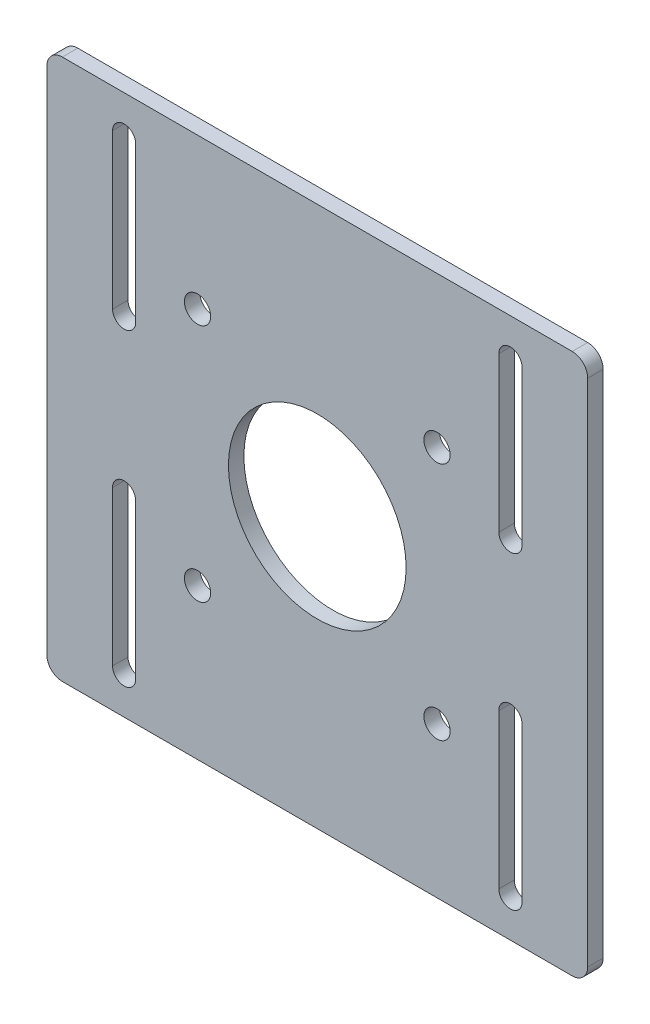
from build123d import *

# Parameters (mm, degrees)
SKIZZE1_W                        = 70
SKIZZE1_H                        = 70
AUFSATZ_LINEAR_AUSTRAGEN1_DEPTH  = 2
VERRUNDUNG2_R                    = 2
F_23_0_23_DURCHMESSER_BOHRUNG1_D = 23
DURCHGANGSLOCH_F_R_M31_D         = 3.4
SCHNITT_LINEAR_AUSTRAGEN1_DEPTH  = 50.537864306


with BuildPart() as part:
    # Skizze1 → Aufsatz-Linear austragen1 (new body)
    with BuildSketch(Plane.XY):
        Rectangle(SKIZZE1_W, SKIZZE1_H)
    extrude(amount=AUFSATZ_LINEAR_AUSTRAGEN1_DEPTH)

    # Verrundung2
    verrundung2_edges = [part.edges().sort_by_distance(p)[0] for p in [
        (-35, 35, 1),
        (35, 35, 1),
        (35, -35, 1),
        (-35, -35, 1),
    ]]
    fillet(verrundung2_edges, radius=VERRUNDUNG2_R)

    # Ø23.0 (23) Durchmesser Bohrung1 (through all)
    with Locations(Plane.XY.offset(2)):
        with Locations((0, 0)):
            Hole(F_23_0_23_DURCHMESSER_BOHRUNG1_D / 2)

    # Durchgangsloch für M31 (through all)
    with Locations(Plane.XY.offset(2)):
        with Locations((-15.5, 15.5), (15.5, 15.5), (15.5, -15.5), (-15.5, -15.5)):
            Hole(DURCHGANGSLOCH_F_R_M31_D / 2)

    # Skizze8 → Schnitt-Linear austragen1 (cut, through all)
    with BuildSketch(Plane.XY.offset(2)):
        with BuildLine():
            Line((-26.5, 30), (-26.5, 10))
            ThreePointArc((-26.5, 10), (-25, 8.5), (-23.5, 10))
            Line((-23.5, 10), (-23.5, 30))
            ThreePointArc((-23.5, 30), (-25, 31.5), (-26.5, 30))
        make_face()
        with BuildLine():
            Line((-26.5, -10), (-26.5, -30))
            ThreePointArc((-26.5, -30), (-25, -31.5), (-23.5, -30))
            Line((-23.5, -30), (-23.5, -10))
            ThreePointArc((-23.5, -10), (-25, -8.5), (-26.5, -10))
        make_face()
        with BuildLine():
            Line((23.5, -10), (23.5, -30))
            ThreePointArc((23.5, -30), (25, -31.5), (26.5, -30))
            Line((26.5, -30), (26.5, -10))
            ThreePointArc((26.5, -10), (25, -8.5), (23.5, -10))
        make_face()
        with BuildLine():
            Line((23.5, 30), (23.5, 10))
            ThreePointArc((23.5, 10), (25, 8.5), (26.5, 10))
            Line((26.5, 10), (26.5, 30))
            ThreePointArc((26.5, 30), (25, 31.5), (23.5, 30))
        make_face()
    extrude(amount=-SCHNITT_LINEAR_AUSTRAGEN1_DEPTH, mode=Mode.SUBTRACT)


solid = part.part
